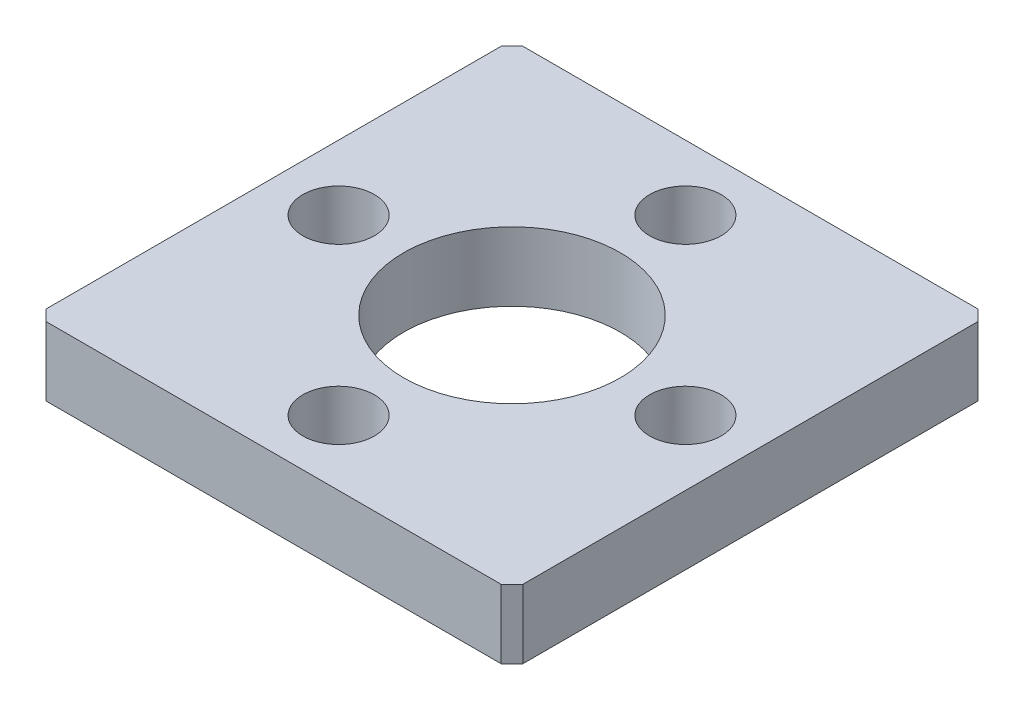
from build123d import *

# Parameters (mm, degrees)
SKETCH1_W                 = 22
SKETCH1_H                 = 22
BOSS_EXTRUDE1_DEPTH       = 3.175
SKETCH2_R                 = 5
CUT_EXTRUDE1_DEPTH        = 16.877047112
CHAMFER1_SIZE             = 0.5
F_3_0MM_DOWEL_HOLE1_D     = 3.3
F_3_0MM_DOWEL_HOLE1_DEPTH = 5
F_3_0MM_DOWEL_HOLE1_TIP   = 0.991420021


with BuildPart() as part:
    # Sketch1 → Boss-Extrude1 (new body)
    with BuildSketch(Plane(origin=(0, 0, 0), x_dir=(1, 0, 0), z_dir=(0, 1, 0))):
        Rectangle(SKETCH1_W, SKETCH1_H)
    extrude(amount=BOSS_EXTRUDE1_DEPTH)

    # Sketch2 → Cut-Extrude1 (cut, through all)
    with BuildSketch(Plane(origin=(0, 3.175, 0), x_dir=(1, 0, 0), z_dir=(0, 1, 0))):
        with Locations(Location((0, 0, 0), (0, 0, 270))):
            Circle(SKETCH2_R)
    extrude(amount=-CUT_EXTRUDE1_DEPTH, mode=Mode.SUBTRACT)

    # Chamfer1
    chamfer1_edges = [part.edges().sort_by_distance(p)[0] for p in [
        (11, 1.5875, 11),
        (-11, 1.5875, 11),
        (-11, 1.5875, -11),
        (11, 1.5875, -11),
    ]]
    chamfer(chamfer1_edges, length=CHAMFER1_SIZE)

    # Ø3.0mm Dowel Hole1
    with Locations(Plane(origin=(0, 3.175, 0), x_dir=(1, 0, 0), z_dir=(0, 1, 0))):
        with Locations((0, 8), (8, 0), (0, -8), (-8, 0)):
            Hole(F_3_0MM_DOWEL_HOLE1_D / 2, depth=F_3_0MM_DOWEL_HOLE1_DEPTH)
            with Locations((0, 0, -(F_3_0MM_DOWEL_HOLE1_DEPTH + F_3_0MM_DOWEL_HOLE1_TIP / 2))):  # 118° drill point
                Cone(0, F_3_0MM_DOWEL_HOLE1_D / 2, F_3_0MM_DOWEL_HOLE1_TIP, mode=Mode.SUBTRACT)


solid = part.part
